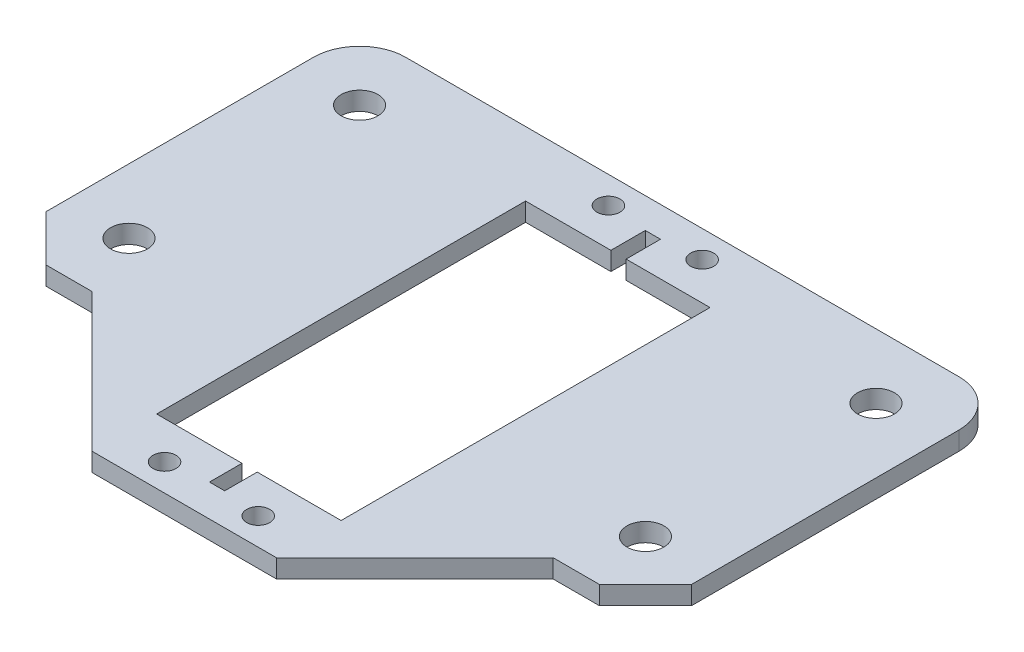
from build123d import *

# Parameters (mm, degrees)
SKETCH_1_W          = 50
SKETCH_1_H          = 54
SKETCH_1_W_2        = 20
SKETCH_1_H_2        = 40
EXTRUDE_1_DEPTH     = 2
SKETCH_2_R          = 1.25
CUT_EXTRUDE_1_DEPTH = 2
CHAMFER_1_SIZE      = 15
SKETCH_3_W          = 39
SKETCH_3_H          = 2
EXTRUDE_2_DEPTH     = 10
SKETCH_4_W          = 39
SKETCH_4_H          = 2
EXTRUDE_3_DEPTH     = 10
CHAMFER_2_SIZE      = 5
SKETCH_5_R          = 2
CUT_EXTRUDE_2_DEPTH = 10
SKETCH_6_W          = 1.650327519
SKETCH_6_H          = 3.527213322
SKETCH_6_H_2        = 3.728223566
CUT_EXTRUDE_3_DEPTH = 10
FILLET_2_R          = 5


with BuildPart() as part:
    # Эскиз1 → Бобышка-Вытянуть1 (new body)
    with BuildSketch(Plane(origin=(0, 0, 0), x_dir=(1, 0, 0), z_dir=(0, 1, 0))):
        with Locations((-5.839311735, -33.32864132)):
            Rectangle(SKETCH_1_W, SKETCH_1_H)
        with Locations((-5.839311735, -33.32864132)):
            Rectangle(SKETCH_1_W_2, SKETCH_1_H_2, mode=Mode.SUBTRACT)
    extrude(amount=EXTRUDE_1_DEPTH)

    # Эскиз2 → Вырез-Вытянуть1 (cut)
    with BuildSketch(Plane(origin=(0, 2, 0), x_dir=(1, 0, 0), z_dir=(0, 1, 0))):
        with Locations(Location((-10.919311735, -57.39514132, 0), (0, 0, 270))):
            Circle(SKETCH_2_R)
        with Locations(Location((-0.759311735, -57.39514132, 0), (0, 0, 270))):
            Circle(SKETCH_2_R)
        with Locations(Location((-10.919311735, -9.26214132, 0), (0, 0, 270))):
            Circle(SKETCH_2_R)
        with Locations(Location((-0.759311735, -9.26214132, 0), (0, 0, 270))):
            Circle(SKETCH_2_R)
    extrude(amount=-CUT_EXTRUDE_1_DEPTH, mode=Mode.SUBTRACT)

    # Фаска1
    chamfer_1_edges = [part.edges().sort_by_distance(p)[0] for p in [
        (19.160688265, 1, 60.32864132),
        (-30.839311735, 1, 60.32864132),
    ]]
    chamfer(chamfer_1_edges, length=CHAMFER_1_SIZE)

    # Эскиз3 → Бобышка-Вытянуть2 (add)
    with BuildSketch(Plane(origin=(19.160688265, 0, 0), x_dir=(0, 0, -1), z_dir=(1, 0, 0))):
        with Locations((-25.82864132, 1)):
            Rectangle(SKETCH_3_W, SKETCH_3_H)
    extrude(amount=EXTRUDE_2_DEPTH)

    # Эскиз4 → Бобышка-Вытянуть3 (add)
    with BuildSketch(Plane.ZY.offset(30.839311735)):
        with Locations((25.82864132, 1)):
            Rectangle(SKETCH_4_W, SKETCH_4_H)
    extrude(amount=EXTRUDE_3_DEPTH)

    # Фаска2
    chamfer_2_edges = [part.edges().sort_by_distance(p)[0] for p in [
        (29.160688265, 1, 45.32864132),
        (-40.839311735, 1, 45.32864132),
    ]]
    chamfer(chamfer_2_edges, length=CHAMFER_2_SIZE)

    # Эскиз5 → Вырез-Вытянуть2 (cut)
    with BuildSketch(Plane(origin=(0, 2, 0), x_dir=(1, 0, 0), z_dir=(0, 1, 0))):
        with Locations(Location((22.160688265, -38.32864132, 0), (0, 0, 270))):
            Circle(SKETCH_5_R)
        with Locations(Location((-33.839311735, -38.32864132, 0), (0, 0, 270))):
            Circle(SKETCH_5_R)
        with Locations(Location((-33.839311735, -13.32864132, 0), (0, 0, 270))):
            Circle(SKETCH_5_R)
        with Locations(Location((22.160688265, -13.32864132, 0), (0, 0, 270))):
            Circle(SKETCH_5_R)
    extrude(amount=-CUT_EXTRUDE_2_DEPTH, mode=Mode.SUBTRACT)

    # Эскиз6 → Вырез-Вытянуть3 (cut)
    with BuildSketch(Plane.XZ):
        with Locations((-5.761377028, 55.092247981)):
            Rectangle(SKETCH_6_W, SKETCH_6_H)
        with Locations((-5.761377028, 11.464529537)):
            Rectangle(SKETCH_6_W, SKETCH_6_H_2)
    extrude(amount=-CUT_EXTRUDE_3_DEPTH, mode=Mode.SUBTRACT)

    # Скругление2
    fillet_2_edges = [part.edges().sort_by_distance(p)[0] for p in [
        (29.160688265, 1, 6.32864132),
        (-40.839311735, 1, 6.32864132),
    ]]
    fillet(fillet_2_edges, radius=FILLET_2_R)


solid = part.part
